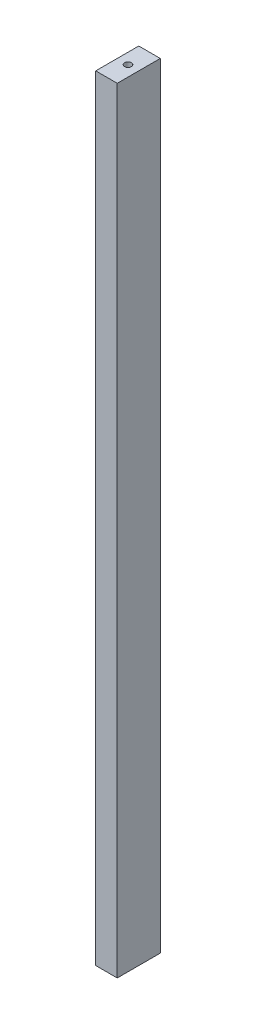
from build123d import *

# Parameters (mm, degrees)
SKETCH_1_W          = 25
SKETCH_1_H          = 50
EXTRUDE_1_DEPTH     = 900
SKETCH_2_R          = 4
CUT_EXTRUDE_1_DEPTH = 10
CUT_EXTRUDE_START   = -10
SKETCH_3_R          = 4
CUT_EXTRUDE_2_DEPTH = 10


with BuildPart() as part:
    # Эскиз1 → Бобышка-Вытянуть1 (new body)
    with BuildSketch(Plane(origin=(0, 0, 0), x_dir=(1, 0, 0), z_dir=(0, 1, 0))):
        Rectangle(SKETCH_1_W, SKETCH_1_H)
    extrude(amount=EXTRUDE_1_DEPTH)

    # Эскиз2 → Вырез-Вытянуть1 (cut)
    with BuildSketch(Plane.XZ):
        with Locations(Location((0, 0, 0), (0, 0, 270))):
            Circle(SKETCH_2_R)
    extrude(amount=-CUT_EXTRUDE_1_DEPTH, mode=Mode.SUBTRACT)

    # Эскиз3 → Вырез-Вытянуть2 (cut)
    with BuildSketch(Plane(origin=(0, 900, 0), x_dir=(1, 0, 0), z_dir=(0, 1, 0)).offset(CUT_EXTRUDE_START)):
        with Locations(Location((0, 0, 0), (0, 0, 90))):
            Circle(SKETCH_3_R)
    extrude(amount=CUT_EXTRUDE_2_DEPTH, mode=Mode.SUBTRACT)


solid = part.part
